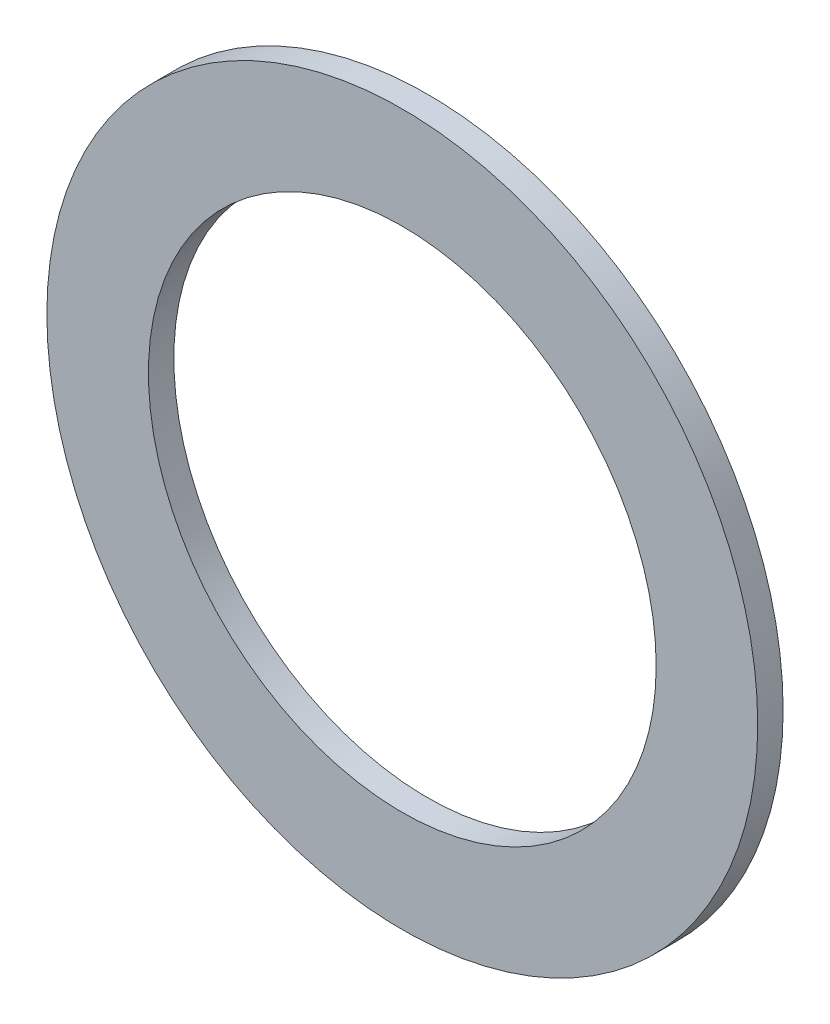
from build123d import *

# Parameters (mm, degrees)
SKETCH_1_R      = 7
SKETCH_1_R_2    = 5
EXTRUDE_1_DEPTH = 0.5


with BuildPart() as part:
    # 草图1 → 凸台-拉伸1 (new body)
    with BuildSketch(Plane.XY):
        Circle(SKETCH_1_R)
        Circle(SKETCH_1_R_2, mode=Mode.SUBTRACT)
    extrude(amount=EXTRUDE_1_DEPTH)


solid = part.part
